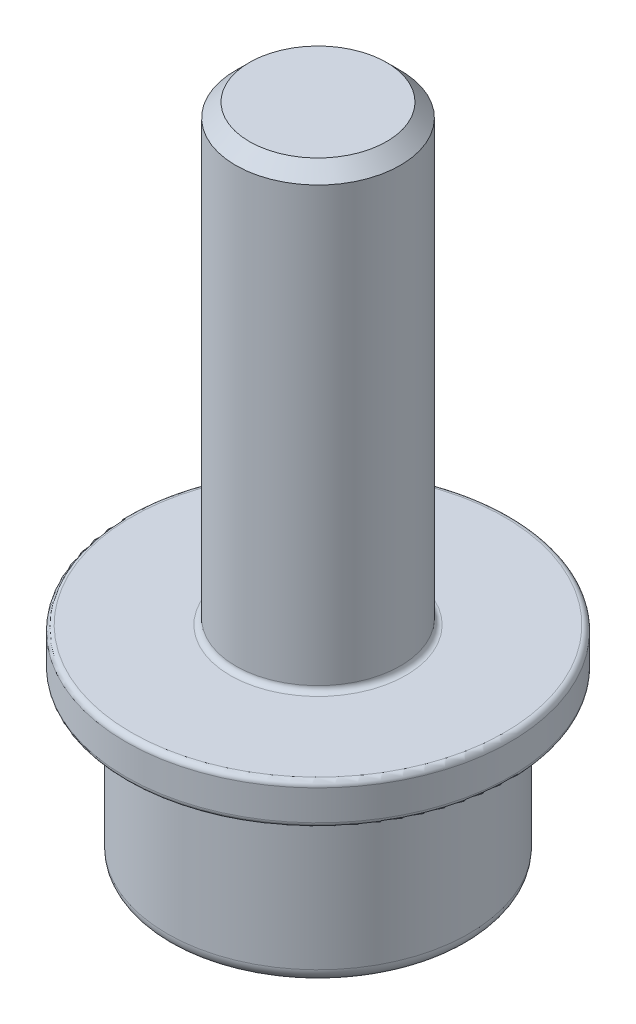
from build123d import *

# Parameters (mm, degrees)
SKETCH1_R           = 2.75
BOSS_EXTRUDE1_DEPTH = 3
SKETCH2_R           = 1.5
BOSS_EXTRUDE2_DEPTH = 9
CUT_EXTRUDE1_DEPTH  = 1.5
CHAMFER1_SIZE       = 0.25
FILLET1_R           = 0.25
CHAMFER2_SIZE       = 0.25
FILLET2_R           = 0.1
SKETCH4_R           = 3.5
SKETCH4_R_2         = 1.5
BOSS_EXTRUDE3_DEPTH = 0.75
FILLET3_R           = 0.1


with BuildPart() as part:
    # Sketch1 → Boss-Extrude1 (new body)
    with BuildSketch(Plane(origin=(0, 0, 0), x_dir=(1, 0, 0), z_dir=(0, 1, 0))):
        with Locations(Location((0, 0, 0), (0, 0, 270))):
            Circle(SKETCH1_R)
    extrude(amount=BOSS_EXTRUDE1_DEPTH)

    # Sketch2 → Boss-Extrude2 (add)
    with BuildSketch(Plane(origin=(0, 3, 0), x_dir=(1, 0, 0), z_dir=(0, 1, 0))):
        with Locations(Location((0, 0, 0), (0, 0, 270))):
            Circle(SKETCH2_R)
    extrude(amount=BOSS_EXTRUDE2_DEPTH)

    # Sketch3 → Cut-Extrude1 (cut)
    with BuildSketch(Plane.XZ):
        Polygon((0.934168857, 0.974591477), (-0.376936549, 1.2963097), (-1.311105406, 0.321718223), (-0.934168857, -0.974591477), (0.376936549, -1.2963097), (1.311105406, -0.321718223), align=None)
    extrude(amount=-CUT_EXTRUDE1_DEPTH, mode=Mode.SUBTRACT)

    # Chamfer1
    chamfer1_edges = [part.edges().sort_by_distance(p)[0] for p in [
        (1.122637131, 0, 0.326436627),
        (0.278616154, 0, 1.135450588),
        (-0.844020977, 0, 0.809013962),
        (-1.122637131, 0, -0.326436627),
        (-0.278616154, 0, -1.135450588),
        (0.844020977, 0, -0.809013962),
    ]]
    chamfer(chamfer1_edges, length=CHAMFER1_SIZE)

    # Fillet1
    fillet1_edges = [part.edges().sort_by_distance(p)[0] for p in [
        (0, 0, -2.75),
    ]]
    fillet(fillet1_edges, radius=FILLET1_R)

    # Chamfer2
    chamfer2_edges = [part.edges().sort_by_distance(p)[0] for p in [
        (0, 12, -1.5),
    ]]
    chamfer(chamfer2_edges, length=CHAMFER2_SIZE)

    # Fillet2
    fillet2_edges = [part.edges().sort_by_distance(p)[0] for p in [
        (0, 3, -2.75),
    ]]
    fillet(fillet2_edges, radius=FILLET2_R)

    # Sketch4 → Boss-Extrude3 (add)
    with BuildSketch(Plane(origin=(0, 3, 0), x_dir=(1, 0, 0), z_dir=(0, 1, 0))):
        with Locations(Location((0, 0, 0), (0, 0, 270))):
            Circle(SKETCH4_R)
        with Locations(Location((0, 0, 0), (0, 0, 270))):
            Circle(SKETCH4_R_2, mode=Mode.SUBTRACT)
    extrude(amount=BOSS_EXTRUDE3_DEPTH)

    # Fillet3
    fillet3_edges = [part.edges().sort_by_distance(p)[0] for p in [
        (0, 3.75, -3.5),
        (0, 3, -3.5),
        (0, 3.75, -1.5),
    ]]
    fillet(fillet3_edges, radius=FILLET3_R)


solid = part.part
